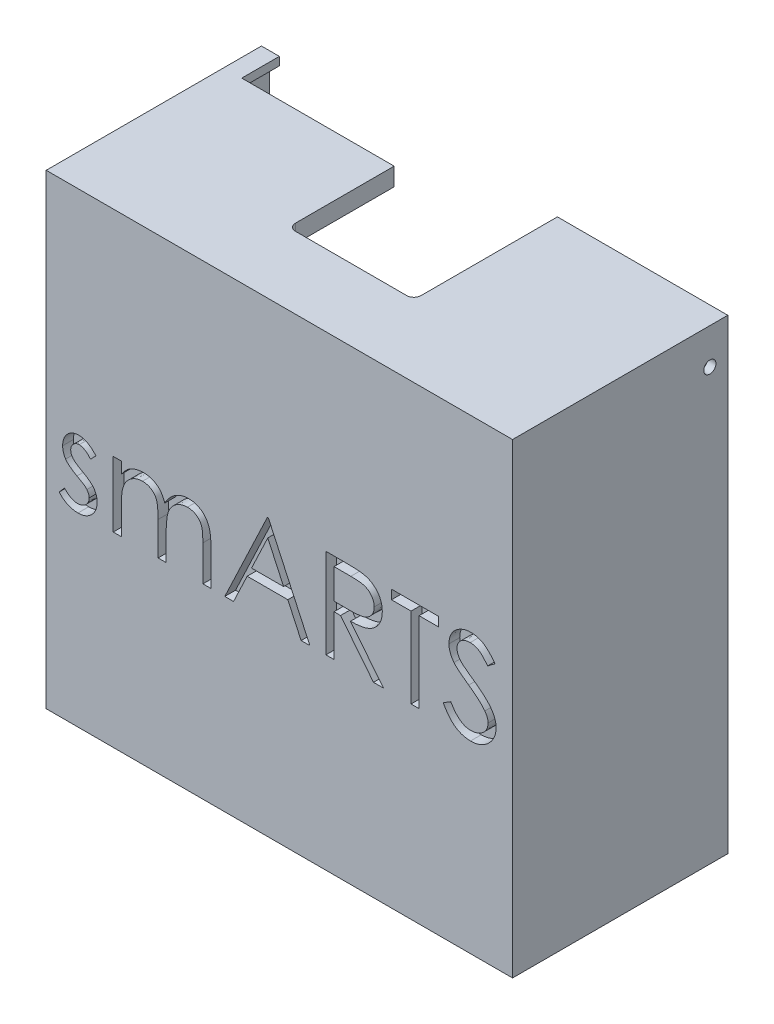
from build123d import *

# Parameters (mm, degrees)
CROQUIS1_W              = 130
CROQUIS1_H              = 130
SALIENTE_EXTRUIR1_DEPTH = 60
CROQUIS2_W              = 125.4
CROQUIS2_H              = 125.4
CORTAR_EXTRUIR1_DEPTH   = 10.4
CROQUIS3_W              = 120
CROQUIS3_H              = 120
CORTAR_EXTRUIR2_DEPTH   = 45
CORTAR_EXTRUIR3_DEPTH   = 3
CROQUIS5_R              = 1.7
CORTAR_EXTRUIR4_DEPTH   = 158.241852097
CORTAR_EXTRUIR6_REACH   = 155.134
CROQUIS6_W              = 35
CROQUIS6_H              = 40
REDONDEO1_R             = 2
CORTAR_EXTRUIR7_REACH   = 159.242
CROQUIS7_W              = 77.5
CROQUIS7_H              = 10.5


with BuildPart() as part:
    # Croquis1 → Saliente-Extruir1 (new body)
    with BuildSketch(Plane.XY):
        Rectangle(CROQUIS1_W, CROQUIS1_H)
    extrude(amount=SALIENTE_EXTRUIR1_DEPTH)

    # Croquis2 → Cortar-Extruir1 (cut)
    with BuildSketch(Plane(origin=(0, 0, 0), x_dir=(-1, 0, 0), z_dir=(0, 0, -1))):
        Rectangle(CROQUIS2_W, CROQUIS2_H)
    extrude(amount=-CORTAR_EXTRUIR1_DEPTH, mode=Mode.SUBTRACT)

    # Croquis3 → Cortar-Extruir2 (cut)
    with BuildSketch(Plane(origin=(0, 0, 10.4), x_dir=(-1, 0, 0), z_dir=(0, 0, -1))):
        Rectangle(CROQUIS3_W, CROQUIS3_H)
    extrude(amount=-CORTAR_EXTRUIR2_DEPTH, mode=Mode.SUBTRACT)

    # Croquis4 → Cortar-Extruir3 (cut)
    # profile 1 of 6: a face of its own
    with BuildSketch(Plane.XY.offset(60)):
        with BuildLine():
            Line((-51.121794872, 2.990584936), (-52.644230769, 1.423076923))
            add(Edge.make_bspline(
                [(-52.644230769, 1.423076923), (-52.775591509, 1.575313683), (-53.02883955, 1.868808233), (-53.430492986, 2.261215851), (-53.830661583, 2.590765415), (-54.223867394, 2.868995836), (-54.619997887, 3.079346883), (-55.014404445, 3.232881611), (-55.407495435, 3.327894508), (-55.670252829, 3.340140499), (-55.799278846, 3.346153846)],
                knots=[0, 0, 0, 0, 1.26578478, 2.440284043, 3.530471711, 4.527705817, 5.468200915, 6.346673037, 7.188140097, 8, 8, 8, 8], degree=3))
            add(Edge.make_bspline(
                [(-55.799278846, 3.346153846), (-55.957417345, 3.338476182), (-56.26861153, 3.323367626), (-56.714510233, 3.172557409), (-57.128443269, 2.94106642), (-57.486707411, 2.612719395), (-57.79019084, 2.23583176), (-58.011717133, 1.814429439), (-58.147188445, 1.361229127), (-58.164365102, 1.046730144), (-58.173076923, 0.887219551)],
                knots=[0, 0, 0, 0, 0.99966794, 1.967205029, 2.953328237, 3.988086729, 5.028030931, 6.008226631, 6.989793394, 8, 8, 8, 8], degree=3))
            add(Edge.make_bspline(
                [(-58.173076923, 0.887219551), (-58.16514255, 0.742847807), (-58.14929617, 0.454511301), (-58.026105604, 0.029168203), (-57.829919374, -0.385524927), (-57.646560844, -0.639545687), (-57.552083333, -0.770432692)],
                knots=[0, 0, 0, 0, 0.960159726, 1.917612774, 2.927026955, 4, 4, 4, 4], degree=3))
            add(Edge.make_bspline(
                [(-57.552083333, -0.770432692), (-57.495201235, -0.84032258), (-57.374134858, -0.989074399), (-57.146931179, -1.195530494), (-56.889627587, -1.42368943), (-56.580199461, -1.651809694), (-56.231977833, -1.892036303), (-55.837411517, -2.134908681), (-55.409022196, -2.398940287), (-55.102327149, -2.566400541), (-54.942908654, -2.653445513)],
                knots=[0, 0, 0, 0, 0.66740084, 1.420478572, 2.27185888, 3.217733974, 4.268547843, 5.408967954, 6.65319498, 8, 8, 8, 8], degree=3))
            add(Edge.make_bspline(
                [(-54.942908654, -2.653445513), (-54.74852596, -2.762337676), (-54.373042603, -2.972681479), (-53.839522837, -3.299179361), (-53.355329687, -3.623689534), (-52.916360632, -3.94274149), (-52.531061998, -4.265261973), (-52.187743764, -4.578888809), (-51.894969165, -4.893098154), (-51.731012546, -5.112620394), (-51.652644231, -5.217548077)],
                knots=[0, 0, 0, 0, 1.27191281, 2.456916733, 3.569705269, 4.599008579, 5.553216877, 6.436649441, 7.252746552, 8, 8, 8, 8], degree=3))
            add(Edge.make_bspline(
                [(-51.652644231, -5.217548077), (-51.522569035, -5.429448706), (-51.263695254, -5.851170285), (-50.991850494, -6.545587624), (-50.834277102, -7.282091213), (-50.8124041, -7.785892785), (-50.801282051, -8.042067308)],
                knots=[0, 0, 0, 0, 0.995354457, 1.980940102, 2.973342416, 4, 4, 4, 4], degree=3))
            add(Edge.make_bspline(
                [(-50.801282051, -8.042067308), (-50.806421579, -8.222561209), (-50.816549578, -8.57824416), (-50.886964342, -9.102064372), (-51.008071316, -9.603025498), (-51.173026701, -10.086563246), (-51.395772222, -10.543412814), (-51.656827916, -10.985100307), (-51.970220143, -11.402071241), (-52.328015683, -11.7937781), (-52.719769211, -12.151533438), (-53.1376702, -12.465990252), (-53.582233275, -12.727235517), (-54.050281857, -12.943416555), (-54.542879386, -13.115332683), (-55.060102881, -13.234350763), (-55.600308271, -13.305584771), (-55.967664043, -13.315473887), (-56.154847756, -13.320512821)],
                knots=[0, 0, 0, 0, 1.032770009, 2.035186124, 3.017557409, 3.978232242, 4.952395191, 5.920591857, 6.910227898, 7.931268572, 8.952309245, 9.941945286, 10.918353717, 11.897095711, 12.887975737, 13.898235213, 14.929059601, 16, 16, 16, 16], degree=3))
            add(Edge.make_bspline(
                [(-56.154847756, -13.320512821), (-56.407470438, -13.313422104), (-56.909205631, -13.299339196), (-57.651275053, -13.167153044), (-58.376423329, -12.961471659), (-59.079162903, -12.677786415), (-59.743778002, -12.319567037), (-60.351856035, -11.89054994), (-60.905509338, -11.404907102), (-61.220639865, -11.032672025), (-61.378205128, -10.846554487)],
                knots=[0, 0, 0, 0, 1.013940152, 2.01379169, 3.017749504, 4.037548394, 5.051665909, 6.043208538, 7.021604269, 8, 8, 8, 8], degree=3))
            Line((-61.378205128, -10.846554487), (-59.890825321, -9.153846154))
            add(Edge.make_bspline(
                [(-59.890825321, -9.153846154), (-59.749593799, -9.306380186), (-59.475795141, -9.602090472), (-59.037929306, -9.995835762), (-58.592362156, -10.325844842), (-58.143542966, -10.601869233), (-57.684828006, -10.814550684), (-57.218787905, -10.963969212), (-56.74637059, -11.059999156), (-56.42906962, -11.071272602), (-56.270032051, -11.076923077)],
                knots=[0, 0, 0, 0, 1.179806542, 2.287233372, 3.337373186, 4.324005949, 5.273901747, 6.200048787, 7.097828587, 8, 8, 8, 8], degree=3))
            add(Edge.make_bspline(
                [(-56.270032051, -11.076923077), (-56.053475437, -11.067131471), (-55.63036014, -11.048000315), (-55.024333293, -10.8743068), (-54.464771676, -10.601950002), (-53.978890636, -10.215630729), (-53.565303771, -9.765948068), (-53.265816811, -9.259418644), (-53.078129844, -8.710908239), (-53.056086996, -8.330677506), (-53.044871795, -8.137219551)],
                knots=[0, 0, 0, 0, 1.072336372, 2.095165389, 3.102688358, 4.141489647, 5.156069229, 6.117746104, 7.042326257, 8, 8, 8, 8], degree=3))
            add(Edge.make_bspline(
                [(-53.044871795, -8.137219551), (-53.05263104, -7.977865132), (-53.067950631, -7.663241163), (-53.188259717, -7.207881584), (-53.378351519, -6.775958151), (-53.565527579, -6.523174956), (-53.660857372, -6.39443109)],
                knots=[0, 0, 0, 0, 1.013901739, 2.00181326, 2.98231254, 4, 4, 4, 4], degree=3))
            add(Edge.make_bspline(
                [(-53.660857372, -6.39443109), (-53.718160189, -6.329892789), (-53.842986421, -6.18930506), (-54.07195243, -5.986268782), (-54.346108589, -5.767425217), (-54.668538324, -5.536485296), (-55.039891623, -5.296495258), (-55.46167359, -5.048714171), (-55.928106109, -4.781373272), (-56.257896332, -4.60409002), (-56.430288462, -4.511418269)],
                knots=[0, 0, 0, 0, 0.615000592, 1.339693406, 2.178160186, 3.116406724, 4.166410947, 5.330106347, 6.604359322, 8, 8, 8, 8], degree=3))
            add(Edge.make_bspline(
                [(-56.430288462, -4.511418269), (-56.61633589, -4.407567329), (-56.97714123, -4.206167212), (-57.488193308, -3.892480925), (-57.949245838, -3.573428963), (-58.371392799, -3.266908683), (-58.743971411, -2.956759083), (-59.065513899, -2.642635858), (-59.348679726, -2.337207386), (-59.505446953, -2.120798125), (-59.580328526, -2.017427885)],
                knots=[0, 0, 0, 0, 1.262093308, 2.447601706, 3.550203992, 4.582594899, 5.537233252, 6.418365656, 7.244515135, 8, 8, 8, 8], degree=3))
            add(Edge.make_bspline(
                [(-59.580328526, -2.017427885), (-59.709832809, -1.80924492), (-59.968886632, -1.39280624), (-60.220423712, -0.697731406), (-60.393323918, 0.034019004), (-60.408769562, 0.538925106), (-60.416666667, 0.797075321)],
                knots=[0, 0, 0, 0, 0.985009483, 1.970363186, 2.962279964, 4, 4, 4, 4], degree=3))
            add(Edge.make_bspline(
                [(-60.416666667, 0.797075321), (-60.412850986, 0.965828163), (-60.405383158, 1.296101384), (-60.345782789, 1.781378672), (-60.237270566, 2.242436914), (-60.101163977, 2.686200221), (-59.911999659, 3.104072321), (-59.685957479, 3.501625686), (-59.420333016, 3.878310815), (-59.11430951, 4.228333187), (-58.777833472, 4.546256946), (-58.414299403, 4.823390003), (-58.031883284, 5.059863966), (-57.628966002, 5.258186541), (-57.201676909, 5.408196417), (-56.753002721, 5.511463453), (-56.283851615, 5.580429188), (-55.963129286, 5.586594075), (-55.799278846, 5.58974359)],
                knots=[0, 0, 0, 0, 1.087655834, 2.128696564, 3.144119009, 4.137814668, 5.115653402, 6.093965665, 7.082169637, 8.081268856, 9.086088321, 10.061021666, 11.022561449, 11.980240094, 12.950172527, 13.934149372, 14.944599409, 16, 16, 16, 16], degree=3))
            add(Edge.make_bspline(
                [(-55.799278846, 5.58974359), (-55.605049821, 5.581855442), (-55.212948237, 5.565931173), (-54.624700908, 5.439461954), (-54.037319893, 5.231368353), (-53.449295965, 4.943966687), (-52.864936755, 4.57206043), (-52.279102064, 4.122565435), (-51.684758991, 3.598438903), (-51.313642469, 3.19773015), (-51.121794872, 2.990584936)],
                knots=[0, 0, 0, 0, 0.845714091, 1.707292901, 2.609013841, 3.555613372, 4.552488639, 5.621697636, 6.770543573, 8, 8, 8, 8], degree=3))
        make_face()
    # profile 2 of 6: a face of its own
    with BuildSketch(Plane.XY.offset(60)):
        with BuildLine():
            Line((-46.314102564, 5.269230769), (-44.070512821, 5.269230769))
            Line((-44.070512821, 5.269230769), (-44.070512821, 2.094150641))
            add(Edge.make_bspline(
                [(-44.070512821, 2.094150641), (-43.868484607, 2.371919225), (-43.481379181, 2.904150461), (-42.84662452, 3.605509634), (-42.212509431, 4.200710739), (-41.755842419, 4.513159822), (-41.536458333, 4.663261218)],
                knots=[0, 0, 0, 0, 1.134379233, 2.173579362, 3.122582517, 4, 4, 4, 4], degree=3))
            add(Edge.make_bspline(
                [(-41.536458333, 4.663261218), (-41.237425032, 4.806156684), (-40.644582891, 5.089451065), (-39.705874142, 5.376833629), (-38.745340788, 5.553441496), (-38.096710689, 5.577594163), (-37.770432692, 5.58974359)],
                knots=[0, 0, 0, 0, 1.014936303, 2.012140481, 3.000054389, 4, 4, 4, 4], degree=3))
            add(Edge.make_bspline(
                [(-37.770432692, 5.58974359), (-37.549768431, 5.582277227), (-37.113085724, 5.567501697), (-36.466056509, 5.471358588), (-35.838494996, 5.305171638), (-35.234109072, 5.073690753), (-34.664675648, 4.793357275), (-34.14260995, 4.46443079), (-33.673865606, 4.095165965), (-33.258679525, 3.668887873), (-32.885329344, 3.173626455), (-32.541909011, 2.596024677), (-32.224586065, 1.923112812), (-32.048719574, 1.434780376), (-31.956129808, 1.177684295)],
                knots=[0, 0, 0, 0, 1.009824226, 1.998387844, 2.986035974, 3.974953746, 4.955485308, 5.885931332, 6.793869504, 7.679848016, 8.601185859, 9.625726857, 10.749998409, 12, 12, 12, 12], degree=3))
            add(Edge.make_bspline(
                [(-31.956129808, 1.177684295), (-31.858192298, 1.35428729), (-31.665465033, 1.701817182), (-31.341853339, 2.193661913), (-31.00279765, 2.653710426), (-30.645408414, 3.082327743), (-30.27094708, 3.477397246), (-29.877651363, 3.840225115), (-29.467760067, 4.172369498), (-28.897815496, 4.560392066), (-28.156296872, 4.972543361), (-27.221381767, 5.32988939), (-26.248880542, 5.550718878), (-25.588754125, 5.576649399), (-25.255408654, 5.58974359)],
                knots=[0, 0, 0, 0, 0.86119277, 1.694706429, 2.50939023, 3.298075842, 4.073795165, 4.829715201, 5.57930267, 6.321991688, 7.768977793, 9.186738141, 10.579381044, 12, 12, 12, 12], degree=3))
            add(Edge.make_bspline(
                [(-25.255408654, 5.58974359), (-24.949112491, 5.578192012), (-24.34966116, 5.555584453), (-23.476966405, 5.378059644), (-22.663096367, 5.073219307), (-21.909688681, 4.65726476), (-21.229975728, 4.134556308), (-20.639144948, 3.512636039), (-20.14078521, 2.795903018), (-19.815223498, 2.121674527), (-19.594400182, 1.52642215), (-19.458248508, 1.019234355), (-19.337964972, 0.461008977), (-19.238098934, -0.148921463), (-19.165109276, -0.812711522), (-19.111032737, -1.529274921), (-19.074432212, -2.299168576), (-19.071845981, -2.83035072), (-19.070512821, -3.104166667)],
                knots=[0, 0, 0, 0, 1.209669288, 2.367440248, 3.500751976, 4.631527125, 5.755587489, 6.87532382, 8.007944318, 9.190864318, 9.82315674, 10.514484317, 11.263564316, 12.079023757, 12.955305781, 13.901327259, 14.918167583, 16, 16, 16, 16], degree=3))
            Line((-19.070512821, -3.104166667), (-19.070512821, -13))
            Line((-19.070512821, -13), (-21.314102564, -13))
            Line((-21.314102564, -13), (-21.314102564, -3.094150641))
            add(Edge.make_bspline(
                [(-21.314102564, -3.094150641), (-21.314658871, -2.860432256), (-21.315728008, -2.411261064), (-21.334968234, -1.766600698), (-21.371220477, -1.178969575), (-21.413610754, -0.649168945), (-21.472495107, -0.175963313), (-21.548537476, 0.239696819), (-21.629092333, 0.601081186), (-21.762920841, 1.001695812), (-21.976834352, 1.443625887), (-22.302673495, 1.920222857), (-22.713174254, 2.335085715), (-23.187175373, 2.69521655), (-23.72680712, 2.988028272), (-24.321555143, 3.197142627), (-24.96772694, 3.326591758), (-25.415032572, 3.33949187), (-25.646033654, 3.346153846)],
                knots=[0, 0, 0, 0, 1.253487763, 2.409012846, 3.458416907, 4.410876679, 5.259312806, 6.014470957, 6.676830364, 7.243083969, 8.276244668, 9.299465089, 10.325150304, 11.392391894, 12.482080715, 13.603491619, 14.762376348, 16, 16, 16, 16], degree=3))
            add(Edge.make_bspline(
                [(-25.646033654, 3.346153846), (-25.929390471, 3.336038436), (-26.489411265, 3.316046541), (-27.306879024, 3.111947448), (-28.092386285, 2.804231372), (-28.822494377, 2.35828525), (-29.494121453, 1.823939794), (-30.07197558, 1.188585538), (-30.549348335, 0.469800346), (-30.87259102, -0.195533242), (-31.076800315, -0.793172127), (-31.211635427, -1.315296213), (-31.316516795, -1.908735983), (-31.414877718, -2.569503775), (-31.479075775, -3.30214792), (-31.537421291, -4.103279356), (-31.564713169, -4.975307638), (-31.568530731, -5.579783985), (-31.570512821, -5.893629808)],
                knots=[0, 0, 0, 0, 1.090531906, 2.155305635, 3.229839962, 4.33261226, 5.44038871, 6.529323825, 7.629011124, 8.757537029, 9.370236727, 10.061839251, 10.834451254, 11.692844982, 12.636905849, 13.66920014, 14.789842145, 16, 16, 16, 16], degree=3))
            Line((-31.570512821, -5.893629808), (-31.570512821, -13))
            Line((-31.570512821, -13), (-33.814102564, -13))
            Line((-33.814102564, -13), (-33.814102564, -3.710136218))
            add(Edge.make_bspline(
                [(-33.814102564, -3.710136218), (-33.814669928, -3.448041084), (-33.81576148, -2.94379639), (-33.834878032, -2.220698709), (-33.871211044, -1.562976708), (-33.913214961, -0.971394824), (-33.973644808, -0.44702819), (-34.042285966, 0.012934367), (-34.123347469, 0.407339732), (-34.257560931, 0.839935338), (-34.462664276, 1.31651336), (-34.792580433, 1.824663511), (-35.20406315, 2.269435636), (-35.686712263, 2.649140982), (-36.229609993, 2.963008706), (-36.829491427, 3.18914979), (-37.480955091, 3.320751859), (-37.930081561, 3.337526835), (-38.161057692, 3.346153846)],
                knots=[0, 0, 0, 0, 1.320475261, 2.540461679, 3.643808994, 4.639130445, 5.527981419, 6.302341397, 6.981980563, 7.553956391, 8.582137848, 9.585246428, 10.591171744, 11.620968678, 12.668337649, 13.738356861, 14.836885341, 16, 16, 16, 16], degree=3))
            add(Edge.make_bspline(
                [(-38.161057692, 3.346153846), (-38.43260206, 3.335221989), (-38.973780341, 3.313435186), (-39.76879441, 3.11733323), (-40.536549293, 2.810161267), (-41.264797142, 2.384019702), (-41.933898201, 1.856169141), (-42.519671539, 1.235348457), (-43.01211815, 0.529283931), (-43.338773971, -0.129034044), (-43.549477357, -0.711700293), (-43.689444033, -1.207064205), (-43.809727075, -1.757065978), (-43.899112944, -2.363402486), (-43.985401627, -3.022124587), (-44.027046692, -3.736513799), (-44.06755785, -4.505957283), (-44.069503669, -5.037189749), (-44.070512821, -5.312700321)],
                knots=[0, 0, 0, 0, 1.098833095, 2.189935336, 3.297829714, 4.440610912, 5.596351641, 6.740013378, 7.886572111, 9.072425424, 9.705826452, 10.395263256, 11.156850408, 11.985370555, 12.878090359, 13.847760091, 14.883794034, 16, 16, 16, 16], degree=3))
            Line((-44.070512821, -5.312700321), (-44.070512821, -13))
            Line((-44.070512821, -13), (-46.314102564, -13))
            Line((-46.314102564, -13), (-46.314102564, 5.269230769))
        make_face()
    # profile 3 of 6: a face of its own
    with BuildSketch(Plane.XY.offset(60)):
        Polygon((-3.044871795, 12), (8.493589744, -13), (6.0546875, -13), (2.358774038, -4.987179487), (-8.974358974, -4.987179487), (-12.775440705, -13), (-15.224358974, -13), (-3.365384615, 12), align=None)
        Polygon((-3.230168269, 7.127203526), (-7.757411859, -2.423076923), (1.176883013, -2.423076923), align=None, mode=Mode.SUBTRACT)
    # profile 4 of 6: a face of its own
    with BuildSketch(Plane.XY.offset(60)):
        with BuildLine():
            Line((12.980769231, 12), (17.983774038, 12))
            add(Edge.make_bspline(
                [(17.983774038, 12), (18.317639242, 11.998888672), (18.958697416, 11.996754798), (19.877077919, 11.984856491), (20.711557183, 11.95075395), (21.461698893, 11.921406926), (22.127489285, 11.867893059), (22.710969934, 11.81674558), (23.209453487, 11.74979086), (23.511209568, 11.687609267), (23.647836538, 11.659455128)],
                knots=[0, 0, 0, 0, 1.410062039, 2.707475311, 3.878576406, 4.937260626, 5.877586885, 6.699081471, 7.410979367, 8, 8, 8, 8], degree=3))
            add(Edge.make_bspline(
                [(23.647836538, 11.659455128), (23.830740997, 11.614263947), (24.192648064, 11.524845635), (24.713719965, 11.335848486), (25.21025085, 11.117136882), (25.680178166, 10.860253165), (26.121148104, 10.563290454), (26.537707466, 10.231375293), (26.931746491, 9.866323823), (27.287329563, 9.458932098), (27.622608504, 9.031528458), (27.905384407, 8.569358766), (28.149144977, 8.086062141), (28.343220098, 7.576723443), (28.499491337, 7.046282215), (28.609678762, 6.489933667), (28.675758673, 5.910212416), (28.682486213, 5.514798782), (28.685897436, 5.314302885)],
                knots=[0, 0, 0, 0, 1.027469482, 2.033020251, 3.019912614, 3.986113645, 4.951240523, 5.91722682, 6.890402269, 7.87763091, 8.8651537, 9.85103654, 10.82876324, 11.815024772, 12.821070561, 13.842952187, 14.906261191, 16, 16, 16, 16], degree=3))
            add(Edge.make_bspline(
                [(28.685897436, 5.314302885), (28.675404592, 4.981194995), (28.654930337, 4.331215224), (28.464036739, 3.387923214), (28.151347312, 2.507999538), (27.720466676, 1.692552124), (27.171756136, 0.957476086), (26.512293342, 0.311829977), (25.741710403, -0.228455113), (25.024358146, -0.603118004), (24.390685291, -0.843067351), (23.869018771, -1.011898486), (23.299968932, -1.142341095), (22.688987971, -1.259199179), (22.033533288, -1.347425568), (21.335175864, -1.4120441), (20.593417638, -1.452430162), (20.083852857, -1.458444483), (19.821714744, -1.461538462)],
                knots=[0, 0, 0, 0, 1.260483769, 2.459530307, 3.627416485, 4.787058657, 5.939039949, 7.08810263, 8.267026773, 9.491475466, 10.141966685, 10.831826277, 11.566392101, 12.351337768, 13.187381173, 14.07005841, 15.007169909, 16, 16, 16, 16], degree=3))
            Line((19.821714744, -1.461538462), (29.006410256, -13))
            Line((29.006410256, -13), (26.231971154, -13))
            Line((26.231971154, -13), (17.047275641, -1.461538462))
            Line((17.047275641, -1.461538462), (15.224358974, -1.461538462))
            Line((15.224358974, -1.461538462), (15.224358974, -13))
            Line((15.224358974, -13), (12.980769231, -13))
            Line((12.980769231, -13), (12.980769231, 12))
        make_face()
        with BuildLine():
            Line((15.224358974, 9.435897436), (15.224358974, 1.102564103))
            Line((15.224358974, 1.102564103), (19.801682692, 1.067508013))
            add(Edge.make_bspline(
                [(19.801682692, 1.067508013), (20.015397256, 1.067413465), (20.42963695, 1.067230205), (21.028927413, 1.095757178), (21.58692821, 1.128209452), (22.101505012, 1.177847634), (22.572887693, 1.241819575), (23.000840644, 1.321840891), (23.386062443, 1.41506991), (23.835337718, 1.559367237), (24.337027228, 1.787981653), (24.882251941, 2.120592358), (25.346554353, 2.538943209), (25.738824798, 3.017325038), (26.054035023, 3.543298244), (26.276263983, 4.110558024), (26.417281428, 4.704783724), (26.433913895, 5.11319878), (26.442307692, 5.319310897)],
                knots=[0, 0, 0, 0, 1.146690395, 2.22261258, 3.21895312, 4.145990853, 4.996080663, 5.770904154, 6.481378293, 7.121626537, 8.300444488, 9.431385265, 10.535395872, 11.636531494, 12.74115979, 13.810798291, 14.895190096, 16, 16, 16, 16], degree=3))
            add(Edge.make_bspline(
                [(26.442307692, 5.319310897), (26.433721113, 5.520357853), (26.416705646, 5.918759557), (26.277785871, 6.50201606), (26.042861719, 7.052494275), (25.726274305, 7.567954882), (25.340566055, 8.035852995), (24.888295964, 8.436189803), (24.381830285, 8.766543122), (23.908464582, 8.97764584), (23.485363064, 9.107073363), (23.11800835, 9.198153104), (22.702926366, 9.271327882), (22.238101662, 9.329956889), (21.725518585, 9.380349348), (21.162585363, 9.414290624), (20.553036932, 9.434389653), (20.130558852, 9.435383145), (19.911858974, 9.435897436)],
                knots=[0, 0, 0, 0, 1.101028733, 2.181837193, 3.264309656, 4.369019818, 5.486613113, 6.575447106, 7.666700264, 8.788928104, 9.402425223, 10.0903467, 10.862060571, 11.710948788, 12.657782767, 13.684531032, 14.801375019, 16, 16, 16, 16], degree=3))
            Line((19.911858974, 9.435897436), (15.224358974, 9.435897436))
        make_face(mode=Mode.SUBTRACT)
    # profile 5 of 6: a face of its own
    with BuildSketch(Plane.XY.offset(60)):
        Polygon((31.25, 9.435897436), (31.25, 12), (44.391025641, 12), (44.391025641, 9.435897436), (38.942307692, 9.435897436), (38.942307692, -13), (36.698717949, -13), (36.698717949, 9.435897436), align=None)
    # profile 6 of 6: a face of its own
    with BuildSketch(Plane.XY.offset(60)):
        with BuildLine():
            Line((45.673076923, -8.177283654), (47.786458333, -6.91025641))
            add(Edge.make_bspline(
                [(47.786458333, -6.91025641), (47.983017171, -7.239287731), (48.359616318, -7.869699045), (48.987840312, -8.721542191), (49.638789678, -9.445557596), (50.317284917, -10.037533364), (51.019184547, -10.503596841), (51.749070645, -10.833612782), (52.504483578, -11.039441178), (53.018582303, -11.064441796), (53.275240385, -11.076923077)],
                knots=[0, 0, 0, 0, 1.272034388, 2.437168799, 3.508375237, 4.49857839, 5.41946034, 6.295179144, 7.148887113, 8, 8, 8, 8], degree=3))
            add(Edge.make_bspline(
                [(53.275240385, -11.076923077), (53.494432245, -11.070818273), (53.928980624, -11.058715486), (54.568710931, -10.942424042), (55.190009519, -10.763765979), (55.780071217, -10.507902182), (56.330754178, -10.19834157), (56.813659145, -9.824440302), (57.231131382, -9.405824547), (57.572625057, -8.938805585), (57.834625309, -8.436540238), (58.035997226, -7.920997728), (58.147747752, -7.384079384), (58.164581706, -7.022576078), (58.173076923, -6.840144231)],
                knots=[0, 0, 0, 0, 1.095163259, 2.171163733, 3.241058638, 4.321873601, 5.38011039, 6.391990106, 7.366004449, 8.327778327, 9.272591725, 10.192022065, 11.087607919, 12, 12, 12, 12], degree=3))
            add(Edge.make_bspline(
                [(58.173076923, -6.840144231), (58.162546132, -6.631995304), (58.141138574, -6.208858953), (57.96019943, -5.584575718), (57.675561953, -4.966771646), (57.412971641, -4.584619749), (57.276642628, -4.386217949)],
                knots=[0, 0, 0, 0, 0.938893495, 1.908633276, 2.914225137, 4, 4, 4, 4], degree=3))
            add(Edge.make_bspline(
                [(57.276642628, -4.386217949), (57.16470967, -4.243026352), (56.929720425, -3.942413505), (56.525738192, -3.494947537), (56.051694518, -3.033387402), (55.523811983, -2.540108423), (54.922861349, -2.038052733), (54.267664817, -1.503279319), (53.541494396, -0.956125197), (53.032212277, -0.5891783), (52.76943109, -0.399839744)],
                knots=[0, 0, 0, 0, 0.722233717, 1.516239348, 2.393582979, 3.351407094, 4.387010283, 5.505090956, 6.712668013, 8, 8, 8, 8], degree=3))
            add(Edge.make_bspline(
                [(52.76943109, -0.399839744), (52.506402546, -0.212492689), (52.003511999, 0.145700613), (51.30023641, 0.677302641), (50.671347389, 1.163330281), (50.119640128, 1.608358939), (49.645357293, 2.012448972), (49.2447615, 2.371719966), (48.928057521, 2.695888258), (48.751946231, 2.906183556), (48.672876603, 3.000600962)],
                knots=[0, 0, 0, 0, 1.452282411, 2.77665338, 3.964542531, 5.026858415, 5.96415736, 6.766646006, 7.446254459, 8, 8, 8, 8], degree=3))
            add(Edge.make_bspline(
                [(48.672876603, 3.000600962), (48.562358422, 3.147751225), (48.345009589, 3.437141966), (48.05810955, 3.889462379), (47.814258387, 4.352485703), (47.623098872, 4.827456164), (47.46212588, 5.307705656), (47.353854946, 5.799500268), (47.286059254, 6.300633257), (47.279116493, 6.637872547), (47.275641026, 6.806690705)],
                knots=[0, 0, 0, 0, 1.068054152, 2.10047183, 3.106115577, 4.101338837, 5.06977816, 6.043150881, 7.020423561, 8, 8, 8, 8], degree=3))
            add(Edge.make_bspline(
                [(47.275641026, 6.806690705), (47.284963947, 7.071189095), (47.303410519, 7.594532407), (47.459414214, 8.359038339), (47.705649168, 9.088941319), (48.050612653, 9.777015131), (48.495308031, 10.405343566), (49.009922134, 10.981154188), (49.622861321, 11.465215489), (50.295380059, 11.888158763), (51.031497002, 12.219201086), (51.802860598, 12.468922373), (52.610696827, 12.610417071), (53.157862074, 12.630722535), (53.435496795, 12.641025641)],
                knots=[0, 0, 0, 0, 1.005424448, 1.989358655, 2.955360095, 3.929531133, 4.905563448, 5.876582895, 6.856512386, 7.866279853, 8.892233794, 9.918561126, 10.94386622, 12, 12, 12, 12], degree=3))
            add(Edge.make_bspline(
                [(53.435496795, 12.641025641), (53.730097511, 12.630864558), (54.315964309, 12.610657407), (55.177744421, 12.434960755), (56.007463824, 12.144241671), (56.674915715, 11.814322685), (57.197292583, 11.484812573), (57.595669245, 11.184670971), (57.999365322, 10.839134481), (58.411637142, 10.447282723), (58.825498995, 10.005520216), (59.247095083, 9.516872438), (59.677411288, 8.98432561), (59.954238861, 8.604150605), (60.096153846, 8.409254808)],
                knots=[0, 0, 0, 0, 1.286793592, 2.559021753, 3.825965368, 5.121522368, 5.803751409, 6.523245864, 7.299691795, 8.125521123, 9.008227632, 9.944561021, 10.946284179, 12, 12, 12, 12], degree=3))
            Line((60.096153846, 8.409254808), (58.067908654, 6.871794872))
            add(Edge.make_bspline(
                [(58.067908654, 6.871794872), (57.945437708, 7.029571232), (57.7095873, 7.333411612), (57.351519537, 7.758921009), (57.014029194, 8.147610149), (56.681526339, 8.485218206), (56.371571828, 8.790233444), (56.070735812, 9.051374564), (55.783347589, 9.271200246), (55.421083942, 9.505797103), (54.965957382, 9.738343557), (54.394639266, 9.935122686), (53.797594445, 10.053373128), (53.39095422, 10.06900804), (53.185096154, 10.076923077)],
                knots=[0, 0, 0, 0, 1.181633172, 2.275549214, 3.290209073, 4.226197932, 5.078386478, 5.862611352, 6.581680152, 7.217281963, 8.414376989, 9.595101626, 10.782541182, 12, 12, 12, 12], degree=3))
            add(Edge.make_bspline(
                [(53.185096154, 10.076923077), (52.92683528, 10.068268077), (52.428803512, 10.051577726), (51.721730397, 9.869292117), (51.085345218, 9.582278829), (50.538541182, 9.180028985), (50.08327706, 8.703450466), (49.753952355, 8.155030073), (49.555736894, 7.549441482), (49.531549182, 7.12700108), (49.519230769, 6.911858974)],
                knots=[0, 0, 0, 0, 1.14458467, 2.207223713, 3.21896685, 4.227309161, 5.202851033, 6.127160689, 7.046193047, 8, 8, 8, 8], degree=3))
            add(Edge.make_bspline(
                [(49.519230769, 6.911858974), (49.522038817, 6.777919842), (49.527659503, 6.50982256), (49.606050915, 6.113740975), (49.706760408, 5.718659979), (49.866350635, 5.326355816), (50.086674232, 4.929967537), (50.375996917, 4.522669412), (50.740377717, 4.100871492), (51.019499234, 3.826533108), (51.166866987, 3.681690705)],
                knots=[0, 0, 0, 0, 0.858281714, 1.717966888, 2.583508476, 3.4729293, 4.427298488, 5.488583878, 6.674047936, 8, 8, 8, 8], degree=3))
            add(Edge.make_bspline(
                [(51.166866987, 3.681690705), (51.221591076, 3.632854806), (51.351602984, 3.51683189), (51.589288168, 3.326887028), (51.903165298, 3.092581512), (52.285038164, 2.802672108), (52.74194789, 2.46637595), (53.27394472, 2.087993006), (53.875098526, 1.655239728), (54.301683639, 1.352685866), (54.52724359, 1.192708333)],
                knots=[0, 0, 0, 0, 0.420754252, 0.999615792, 1.744751191, 2.668019286, 3.750313428, 4.999500688, 6.413464383, 8, 8, 8, 8], degree=3))
            add(Edge.make_bspline(
                [(54.52724359, 1.192708333), (54.798571542, 0.995270051), (55.323960516, 0.612958181), (56.071514658, 0.038560467), (56.749327573, -0.523209309), (57.359779027, -1.068763645), (57.908899802, -1.59396431), (58.390597807, -2.105129883), (58.809781238, -2.59859826), (59.26106137, -3.231259515), (59.722188652, -4.008267259), (60.118199419, -4.960254678), (60.367901901, -5.915942681), (60.400555583, -6.558277227), (60.416666667, -6.875200321)],
                knots=[0, 0, 0, 0, 1.163667725, 2.253281268, 3.268753668, 4.215851969, 5.092017293, 5.902905408, 6.650798638, 7.335211899, 8.59617414, 9.77448103, 10.901945474, 12, 12, 12, 12], degree=3))
            add(Edge.make_bspline(
                [(60.416666667, -6.875200321), (60.411972823, -7.0993315), (60.402676287, -7.543241382), (60.295812617, -8.19506336), (60.13924358, -8.828141001), (59.903263337, -9.434648947), (59.615240778, -10.025682966), (59.249767579, -10.585739397), (58.82614126, -11.127213673), (58.340185796, -11.635667183), (57.808429351, -12.102425725), (57.246402961, -12.517633307), (56.653186725, -12.863835617), (56.031998749, -13.146341632), (55.382696344, -13.367295328), (54.705497888, -13.527387251), (53.999287094, -13.625642329), (53.519283654, -13.635840625), (53.275240385, -13.641025641)],
                knots=[0, 0, 0, 0, 0.983748083, 1.948392443, 2.894712957, 3.844097841, 4.80183111, 5.778335162, 6.776009319, 7.81870978, 8.863265674, 9.881300176, 10.883814829, 11.87499822, 12.874611388, 13.892143829, 14.928324115, 16, 16, 16, 16], degree=3))
            add(Edge.make_bspline(
                [(53.275240385, -13.641025641), (53.086416506, -13.637374344), (52.711146792, -13.630117734), (52.156079064, -13.565965731), (51.612224855, -13.475200705), (51.086408555, -13.331100205), (50.571855615, -13.156264655), (50.07080394, -12.940990851), (49.583010698, -12.683010841), (49.105742249, -12.388046379), (48.64021243, -12.044776775), (48.190787659, -11.644966086), (47.742722048, -11.19964105), (47.309240646, -10.696708455), (46.88157533, -10.144293577), (46.468158119, -9.537227982), (46.060431564, -8.878818312), (45.804606794, -8.415496271), (45.673076923, -8.177283654)],
                knots=[0, 0, 0, 0, 0.915332311, 1.819136955, 2.706846663, 3.586547465, 4.459518054, 5.340707479, 6.227863349, 7.133153174, 8.059268498, 9.028702269, 10.047606654, 11.120612155, 12.245963614, 13.433783089, 14.680604001, 16, 16, 16, 16], degree=3))
        make_face()
    extrude(amount=-CORTAR_EXTRUIR3_DEPTH, mode=Mode.SUBTRACT)

    # Croquis5 → Cortar-Extruir4 (cut, through all)
    with BuildSketch(Plane(origin=(65, 0, 0), x_dir=(0, 0, -1), z_dir=(1, 0, 0))):
        with Locations((-5, 55)):
            Circle(CROQUIS5_R)
    extrude(amount=-CORTAR_EXTRUIR4_DEPTH, mode=Mode.SUBTRACT)

    # Croquis6 → Cortar-Extruir6 (cut, up to next)
    with BuildSketch(Plane.XZ.offset(-60), mode=Mode.PRIVATE) as cortar_extruir6_sk1:
        with Locations((0, 20)):
            Rectangle(CROQUIS6_W, CROQUIS6_H)
    cortar_extruir6_tool1 = extrude(cortar_extruir6_sk1.sketch, amount=-CORTAR_EXTRUIR6_REACH, mode=Mode.PRIVATE) & part.part
    add(cortar_extruir6_tool1.solids().sort_by_distance((0, 60, 20))[0], mode=Mode.SUBTRACT)

    # Redondeo1
    redondeo1_edges = [part.edges().sort_by_distance(p)[0] for p in [
        (-17.5, 62.5, 40),
        (17.5, 62.5, 40),
    ]]
    fillet(redondeo1_edges, radius=REDONDEO1_R)

    # Croquis7 → Cortar-Extruir7 (cut, up to next)
    with BuildSketch(Plane(origin=(0, 65, 0), x_dir=(1, 0, 0), z_dir=(0, 1, 0)), mode=Mode.PRIVATE) as cortar_extruir7_sk1:
        with Locations((-21.25, -5.25)):
            Rectangle(CROQUIS7_W, CROQUIS7_H)
    cortar_extruir7_tool1 = extrude(cortar_extruir7_sk1.sketch, amount=-CORTAR_EXTRUIR7_REACH, mode=Mode.PRIVATE) & part.part
    add(cortar_extruir7_tool1.solids().sort_by_distance((-21.25, 65, 5.25))[0], mode=Mode.SUBTRACT)


solid = part.part
